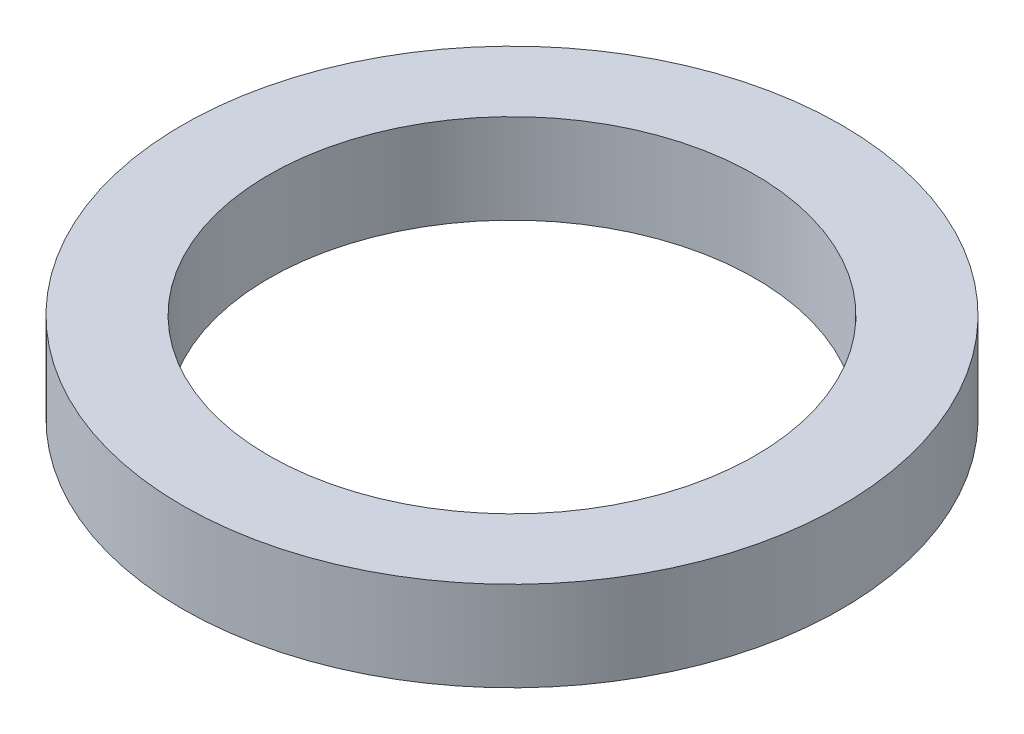
from build123d import *

# Parameters (mm, degrees)
SKETCH1_R           = 33.195
SKETCH1_R_2         = 24.5
BOSS_EXTRUDE1_DEPTH = 4.515


with BuildPart() as part:
    # Sketch1 → Boss-Extrude1 (new, symmetric)
    with BuildSketch(Plane(origin=(0, 0, 0), x_dir=(1, 0, 0), z_dir=(0, 1, 0))):
        with Locations(Location((0, 0, 0), (0, 0, 270))):
            Circle(SKETCH1_R)
        with Locations(Location((0, 0, 0), (0, 0, 270))):
            Circle(SKETCH1_R_2, mode=Mode.SUBTRACT)
    extrude(amount=BOSS_EXTRUDE1_DEPTH, both=True)


solid = part.part
